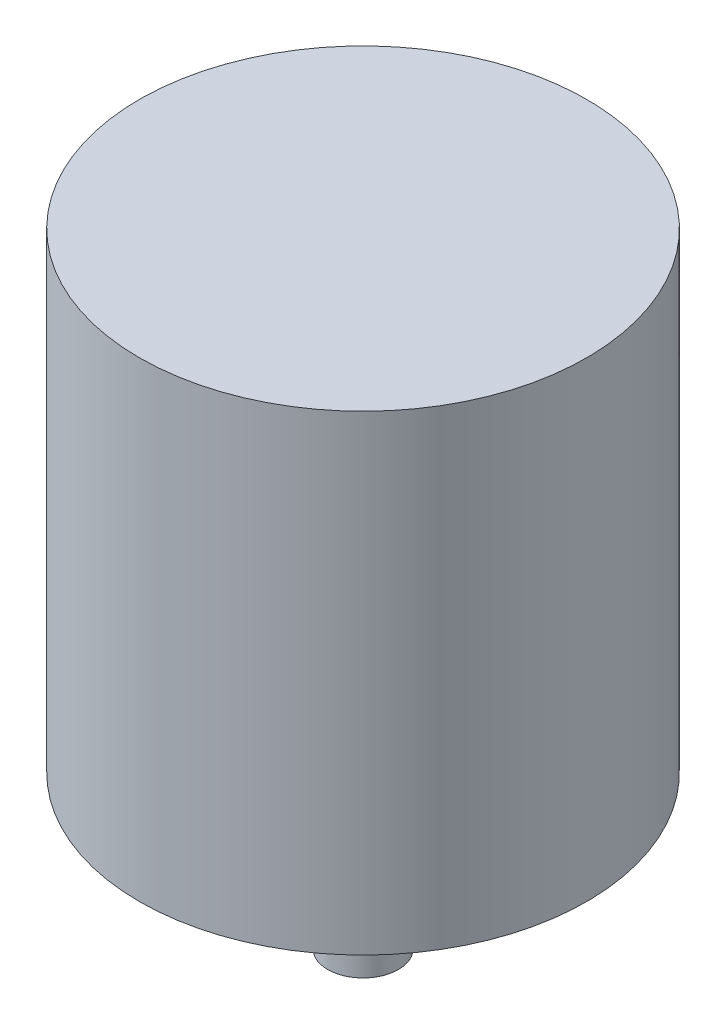
from build123d import *

# Parameters (mm, degrees)
SKETCH1_R           = 19
BOSS_EXTRUDE1_DEPTH = 40
SKETCH2_R           = 3
BOSS_EXTRUDE2_DEPTH = 13


with BuildPart() as part:
    # Sketch1 → Boss-Extrude1 (new body)
    with BuildSketch(Plane(origin=(0, 0, 0), x_dir=(1, 0, 0), z_dir=(0, 1, 0))):
        with Locations(Location((0, 0, 0), (0, 0, 270))):
            Circle(SKETCH1_R)
    extrude(amount=BOSS_EXTRUDE1_DEPTH)

    # Sketch2 → Boss-Extrude2 (add)
    with BuildSketch(Plane.XZ):
        with Locations(Location((0, 0, 0), (0, 0, 90))):
            Circle(SKETCH2_R)
    extrude(amount=BOSS_EXTRUDE2_DEPTH)


solid = part.part
